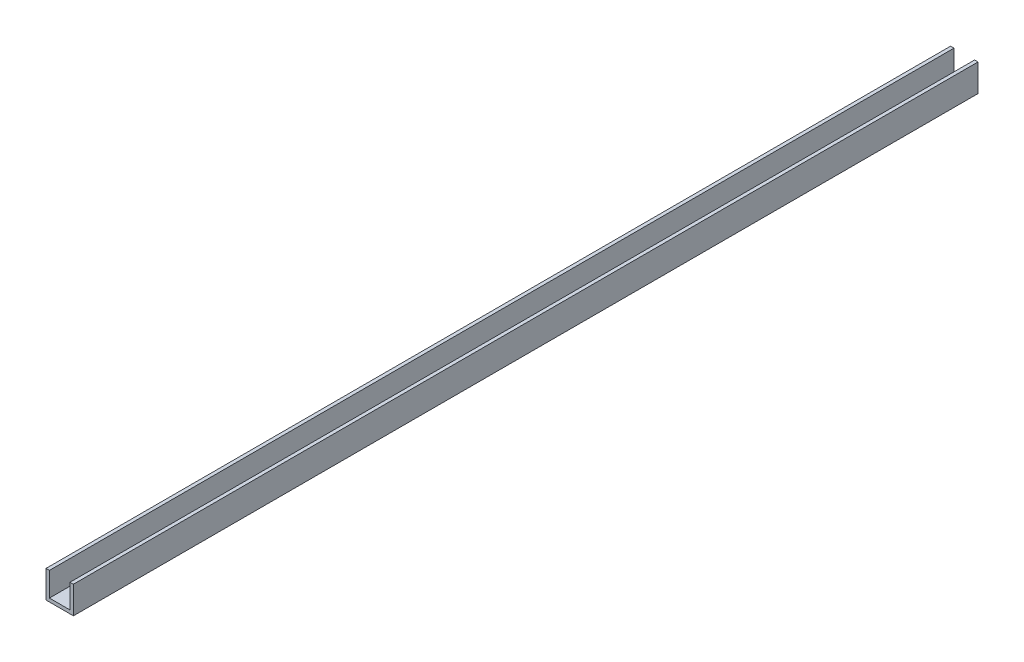
from build123d import *

# Parameters (mm, degrees)
EXTRUDE_THIN1_DEPTH = 838.2


with BuildPart() as part:
    # Sketch1 → Extrude-Thin1 (new body)
    with BuildSketch(Plane.XY):
        Polygon((25.4, 25.4), (25.4, 0), (0, 0), (0, 25.4), (3.175, 25.4), (3.175, 3.175), (22.225, 3.175), (22.225, 25.4), align=None)
    extrude(amount=EXTRUDE_THIN1_DEPTH)


solid = part.part
